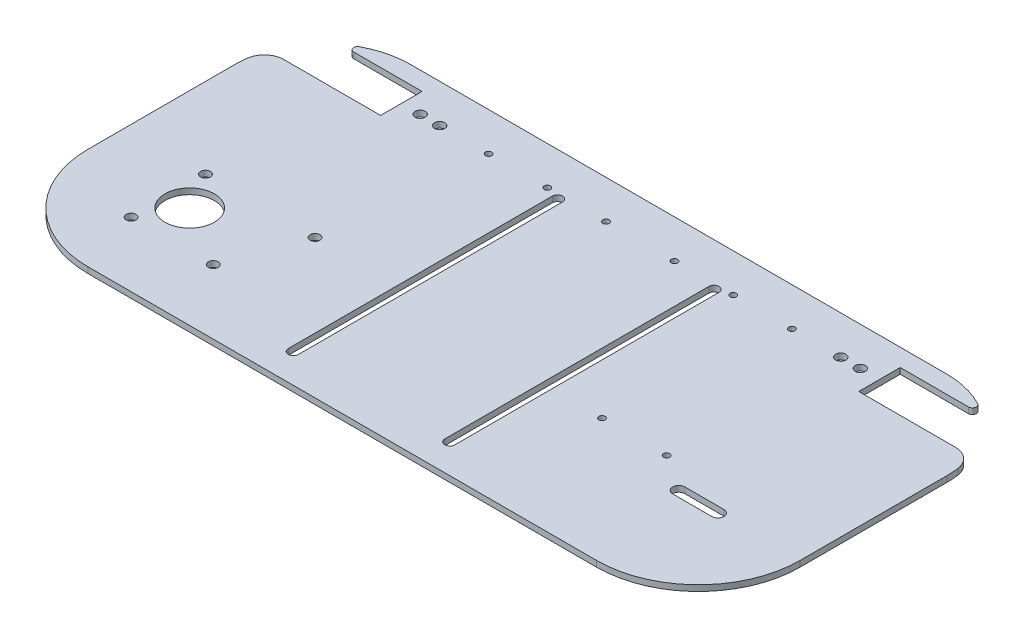
from build123d import *

# Parameters (mm, degrees)
SKETCH1_R           = 3.1
BOSS_EXTRUDE1_DEPTH = 3
CUT_EXTRUDE1_DEPTH  = 335.294780097
FILLET1_R           = 45
SKETCH3_R           = 12.6
CUT_EXTRUDE2_DEPTH  = 335.294780097
SKETCH4_R           = 2.5
CUT_EXTRUDE3_DEPTH  = 335.294780097
SKETCH5_W           = 15.2
SKETCH5_H           = 15.2
SKETCH5_W_2         = 0.2
CUT_EXTRUDE4_DEPTH  = 335.294780097
SKETCH10_R          = 2.6
SKETCH10_R_2        = 1.6
CUT_EXTRUDE8_DEPTH  = 335.294780097
FILLET2_R           = 10
FILLET3_R           = 2
SKETCH11_R          = 1.6
CUT_EXTRUDE9_DEPTH  = 335.294780097


with BuildPart() as part:
    # Sketch1 → Boss-Extrude1 (new body)
    # profile 1 of 2: a face of its own
    with BuildSketch(Plane(origin=(0, 0, 0), x_dir=(1, 0, 0), z_dir=(0, 1, 0))):
        with BuildLine():
            Line((0, -52), (260, -52))
            ThreePointArc((260, -52), (312, 0), (260, 52))
            Line((260, 52), (0, 52))
            ThreePointArc((0, 52), (-52, 0), (0, -52))
        make_face()
        with Locations(Location((0, 0, 0), (0, 0, 270))):
            Circle(SKETCH1_R, mode=Mode.SUBTRACT)
        with BuildLine():
            ThreePointArc((250, 3.1), (246.9, 0), (250, -3.1))
            Line((250, -3.1), (270, -3.1))
            ThreePointArc((270, -3.1), (273.1, 0), (270, 3.1))
            Line((270, 3.1), (250, 3.1))
        make_face(mode=Mode.SUBTRACT)
    # profile 2 of 2: a face of its own
    with BuildSketch(Plane(origin=(0, 0, 0), x_dir=(1, 0, 0), z_dir=(0, 1, 0))):
        with BuildLine():
            ThreePointArc((-52, 0), (-36.769552622, 36.769552622), (0, 52))
            Line((0, 52), (260, 52))
            ThreePointArc((260, 52), (296.769552622, 36.769552622), (312, 0))
            Line((312, 0), (312, 120))
            Line((312, 120), (-52, 120))
            Line((-52, 120), (-52, 0))
        make_face()
    extrude(amount=BOSS_EXTRUDE1_DEPTH)

    # Sketch2 → Cut-Extrude1 (cut, through all)
    with BuildSketch(Plane(origin=(0, 3, 0), x_dir=(1, 0, 0), z_dir=(0, 1, 0))):
        with BuildLine():
            Line((87.4, -37), (87.4, 98))
            ThreePointArc((87.4, 98), (90, 100.6), (92.6, 98))
            Line((92.6, 98), (92.6, -37))
            ThreePointArc((92.6, -37), (90, -39.6), (87.4, -37))
        make_face()
        with BuildLine():
            Line((172.6, -37), (172.6, 98))
            ThreePointArc((172.6, 98), (170, 100.6), (167.4, 98))
            Line((167.4, 98), (167.4, -37))
            ThreePointArc((167.4, -37), (170, -39.6), (172.6, -37))
        make_face()
    extrude(amount=-CUT_EXTRUDE1_DEPTH, mode=Mode.SUBTRACT)

    # Fillet1
    fillet1_edges = [part.edges().sort_by_distance(p)[0] for p in [
        (-52, 1.5, -120),
        (312, 1.5, -120),
    ]]
    fillet(fillet1_edges, radius=FILLET1_R)

    # Sketch3 → Cut-Extrude2 (cut, through all)
    with BuildSketch(Plane(origin=(0, 3, 0), x_dir=(1, 0, 0), z_dir=(0, 1, 0))):
        with Locations(Location((0, 0, 0), (0, 0, 270))):
            Circle(SKETCH3_R)
    extrude(amount=-CUT_EXTRUDE2_DEPTH, mode=Mode.SUBTRACT)

    # Sketch4 → Cut-Extrude3 (cut, through all)
    with BuildSketch(Plane(origin=(0, 3, 0), x_dir=(1, 0, 0), z_dir=(0, 1, 0))):
        with Locations(Location((-10.938925726, 19, 0), (0, 0, 270))):
            Circle(SKETCH4_R)
        with Locations(Location((45.07, 19, 0), (0, 0, 270))):
            Circle(SKETCH4_R)
        with Locations(Location((31.061074274, -19, 0), (0, 0, 270))):
            Circle(SKETCH4_R)
        with Locations(Location((-10.938925726, -19, 0), (0, 0, 270))):
            Circle(SKETCH4_R)
    extrude(amount=-CUT_EXTRUDE3_DEPTH, mode=Mode.SUBTRACT)

    # Sketch5 → Cut-Extrude4 (cut, through all)
    with BuildSketch(Plane(origin=(0, 3, 0), x_dir=(1, 0, 0), z_dir=(0, 1, 0))):
        with BuildLine():
            Line((-52, 108), (-37.594117082, 108))
            ThreePointArc((-37.594117082, 108), (-35.836098568, 109.546771476), (-34, 111))
            Line((-34, 111), (-52, 111))
            Line((-52, 111), (-52, 108))
        make_face()
        with BuildLine():
            Line((-37.594117082, 108), (-7.6, 108))
            Line((-7.6, 108), (7.6, 108))
            Line((7.6, 108), (7.8, 108))
            Line((7.8, 108), (7.8, 111))
            Line((7.8, 111), (-34, 111))
            ThreePointArc((-34, 111), (-35.836098568, 109.546771476), (-37.594117082, 108))
        make_face()
        with BuildLine():
            Line((-48.32989233, 92.8), (-7.6, 92.8))
            Line((-7.6, 92.8), (-7.6, 108))
            Line((-7.6, 108), (-37.594117082, 108))
            ThreePointArc((-37.594117082, 108), (-43.756302622, 100.961013415), (-48.32989233, 92.8))
        make_face()
        with BuildLine():
            Line((7.6, 92.8), (-7.6, 92.8))
            Line((-7.6, 92.8), (-48.32989233, 92.8))
            ThreePointArc((-48.32989233, 92.8), (-48.940072785, 91.310435149), (-49.496588098, 89.8))
            Line((-49.496588098, 89.8), (7.8, 89.8))
            Line((7.8, 89.8), (7.8, 92.8))
            Line((7.8, 92.8), (7.6, 92.8))
        make_face()
        with BuildLine():
            Line((-52, 92.8), (-48.32989233, 92.8))
            ThreePointArc((-48.32989233, 92.8), (-43.756302622, 100.961013415), (-37.594117082, 108))
            Line((-37.594117082, 108), (-52, 108))
            Line((-52, 108), (-52, 92.8))
        make_face()
        with BuildLine():
            ThreePointArc((-49.496588098, 89.8), (-48.940072785, 91.310435149), (-48.32989233, 92.8))
            Line((-48.32989233, 92.8), (-52, 92.8))
            Line((-52, 92.8), (-52, 89.8))
            Line((-52, 89.8), (-49.496588098, 89.8))
        make_face()
        with Locations((0, 100.4)):
            Rectangle(SKETCH5_W, SKETCH5_H)
        with Locations((7.7, 100.4)):
            Rectangle(SKETCH5_W_2, SKETCH5_H)
        with BuildLine():
            Line((252.2, 108), (252.4, 108))
            Line((252.4, 108), (267.6, 108))
            Line((267.6, 108), (297.594117082, 108))
            ThreePointArc((297.594117082, 108), (295.836098568, 109.546771476), (294, 111))
            Line((294, 111), (252.2, 111))
            Line((252.2, 111), (252.2, 108))
        make_face()
        with Locations((260, 100.4)):
            Rectangle(SKETCH5_W, SKETCH5_H)
        with Locations((252.3, 100.4)):
            Rectangle(SKETCH5_W_2, SKETCH5_H)
        with BuildLine():
            Line((267.6, 92.8), (252.4, 92.8))
            Line((252.4, 92.8), (252.2, 92.8))
            Line((252.2, 92.8), (252.2, 89.8))
            Line((252.2, 89.8), (309.496588098, 89.8))
            ThreePointArc((309.496588098, 89.8), (308.940072785, 91.310435149), (308.32989233, 92.8))
            Line((308.32989233, 92.8), (267.6, 92.8))
        make_face()
        with BuildLine():
            Line((297.594117082, 108), (267.6, 108))
            Line((267.6, 108), (267.6, 92.8))
            Line((267.6, 92.8), (308.32989233, 92.8))
            ThreePointArc((308.32989233, 92.8), (303.756302622, 100.961013415), (297.594117082, 108))
        make_face()
        with BuildLine():
            ThreePointArc((294, 111), (295.836098568, 109.546771476), (297.594117082, 108))
            Line((297.594117082, 108), (312, 108))
            Line((312, 108), (312, 111))
            Line((312, 111), (294, 111))
        make_face()
        with BuildLine():
            Line((312, 108), (297.594117082, 108))
            ThreePointArc((297.594117082, 108), (303.756302622, 100.961013415), (308.32989233, 92.8))
            Line((308.32989233, 92.8), (312, 92.8))
            Line((312, 92.8), (312, 108))
        make_face()
        with BuildLine():
            Line((312, 92.8), (308.32989233, 92.8))
            ThreePointArc((308.32989233, 92.8), (308.940072785, 91.310435149), (309.496588098, 89.8))
            Line((309.496588098, 89.8), (312, 89.8))
            Line((312, 89.8), (312, 92.8))
        make_face()
    extrude(amount=-CUT_EXTRUDE4_DEPTH, mode=Mode.SUBTRACT)

    # Sketch10 → Cut-Extrude8 (cut, through all)
    with BuildSketch(Plane(origin=(0, 3, 0), x_dir=(1, 0, 0), z_dir=(0, 1, 0))):
        with Locations(Location((17.4, 100.4, 0), (0, 0, 270))):
            Circle(SKETCH10_R)
        with Locations(Location((27.4, 100.4, 0), (0, 0, 270))):
            Circle(SKETCH10_R)
        with Locations(Location((242.4, 100.4, 0), (0, 0, 270))):
            Circle(SKETCH10_R)
        with Locations(Location((232.4, 100.4, 0), (0, 0, 270))):
            Circle(SKETCH10_R)
        with Locations(Location((207.4, 100.4, 0), (0, 0, 270))):
            Circle(SKETCH10_R_2)
        with Locations(Location((177.4, 100.4, 0), (0, 0, 270))):
            Circle(SKETCH10_R_2)
        with Locations(Location((147.4, 100.4, 0), (0, 0, 270))):
            Circle(SKETCH10_R_2)
        with Locations(Location((112.4, 100.4, 0), (0, 0, 270))):
            Circle(SKETCH10_R_2)
        with Locations(Location((52.4, 100.4, 0), (0, 0, 270))):
            Circle(SKETCH10_R_2)
        with Locations(Location((82.4, 100.4, 0), (0, 0, 270))):
            Circle(SKETCH10_R_2)
    extrude(amount=-CUT_EXTRUDE8_DEPTH, mode=Mode.SUBTRACT)

    # Fillet2
    fillet2_edges = [part.edges().sort_by_distance(p)[0] for p in [
        (-49.496588098, 1.5, -89.8),
        (309.496588098, 1.5, -89.8),
    ]]
    fillet(fillet2_edges, radius=FILLET2_R)

    # Fillet3
    fillet3_edges = [part.edges().sort_by_distance(p)[0] for p in [
        (-34, 1.5, -111),
        (294, 1.5, -111),
    ]]
    fillet(fillet3_edges, radius=FILLET3_R)

    # Sketch11 → Cut-Extrude9 (cut, through all)
    with BuildSketch(Plane.XZ):
        with Locations(Location((231.4, -12.4, 0), (0, 0, 270))):
            Circle(SKETCH11_R)
        with Locations(Location((198.4, -12.4, 0), (0, 0, 270))):
            Circle(SKETCH11_R)
    extrude(amount=-CUT_EXTRUDE9_DEPTH, mode=Mode.SUBTRACT)


solid = part.part
